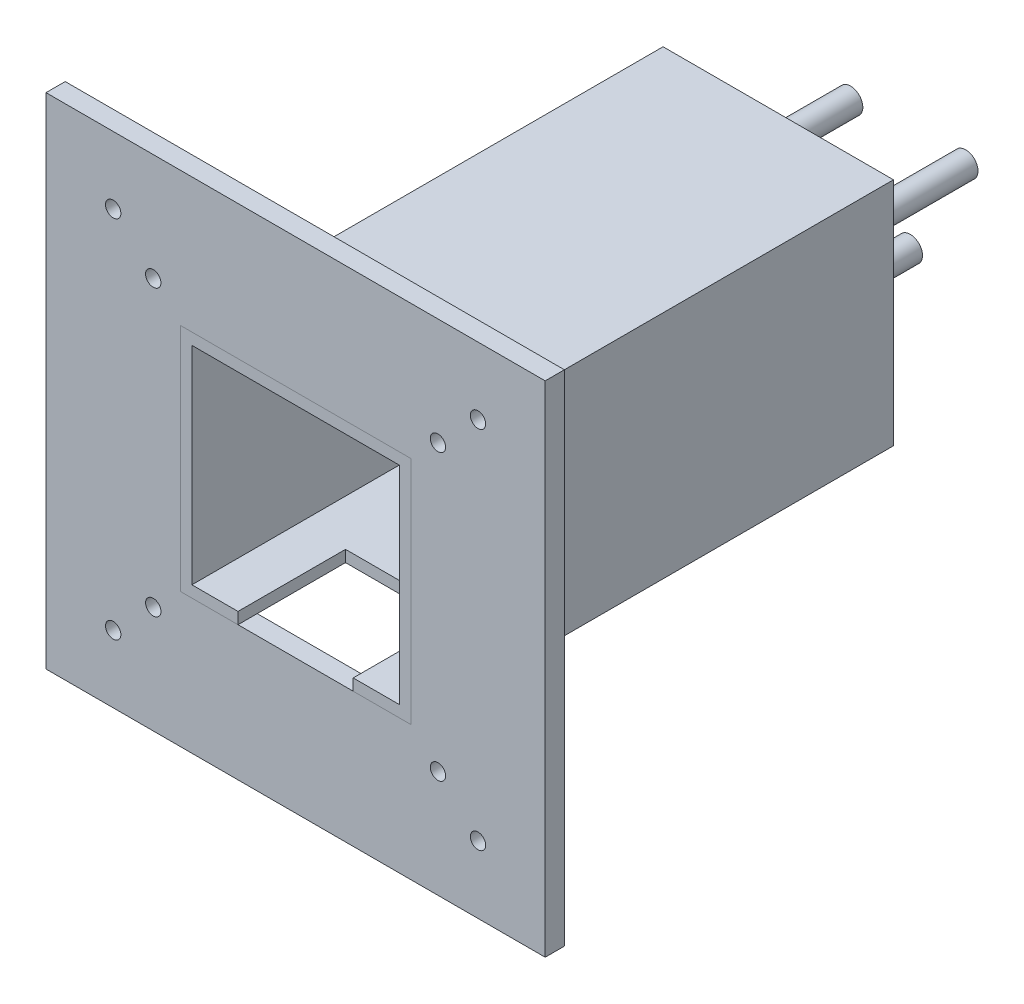
from build123d import *

# Parameters (mm, degrees)
SKETCH1_W           = 60
SKETCH1_H           = 60
SKETCH1_R           = 9
SKETCH1_R_2         = 1.5
BOSS_EXTRUDE1_DEPTH = 4
SKETCH2_R           = 18
SKETCH2_R_2         = 16
BOSS_EXTRUDE2_DEPTH = 30
SKETCH4_R           = 3.2
SKETCH4_R_2         = 2.7
BOSS_EXTRUDE6_DEPTH = 34
SKETCH5_W           = 60
SKETCH5_H           = 60
SKETCH5_W_2         = 54
SKETCH5_H_2         = 54
BOSS_EXTRUDE7_DEPTH = 121.7
SKETCH7_W           = 30
SKETCH7_H           = 28
CUT_EXTRUDE1_DEPTH  = 30.7
SKETCH8_W           = 130
SKETCH8_H           = 130
SKETCH8_R           = 2
SKETCH8_W_2         = 60
SKETCH8_H_2         = 60
BOSS_EXTRUDE8_DEPTH = 5


with BuildPart() as part:
    # Sketch1 → Boss-Extrude1 (new body)
    with BuildSketch(Plane.XY):
        with Locations((-9.011180766, -6.125993037)):
            Rectangle(SKETCH1_W, SKETCH1_H)
        with Locations((-9.011180766, -6.125993037)):
            Circle(SKETCH1_R, mode=Mode.SUBTRACT)
        with Locations((-17.995470725, 2.892105033)):
            Circle(SKETCH1_R_2, mode=Mode.SUBTRACT)
        with Locations((-18.051854011, -15.107894967)):
            Circle(SKETCH1_R_2, mode=Mode.SUBTRACT)
        with Locations((0.004529275, 2.892105033)):
            Circle(SKETCH1_R_2, mode=Mode.SUBTRACT)
        with Locations((-0.051854011, -15.107894967)):
            Circle(SKETCH1_R_2, mode=Mode.SUBTRACT)
    extrude(amount=BOSS_EXTRUDE1_DEPTH)

    # Sketch2 → Boss-Extrude2 (add)
    with BuildSketch(Plane.XY.offset(4)):
        with Locations((-9.011180766, -6.125993037)):
            Circle(SKETCH2_R)
        with Locations((-9.011180766, -6.125993037)):
            Circle(SKETCH2_R_2, mode=Mode.SUBTRACT)
    extrude(amount=BOSS_EXTRUDE2_DEPTH)

    # Sketch4 → Boss-Extrude6 (add)
    # profile 1 of 3: a face of its own
    with BuildSketch(Plane(origin=(0, 0, 0), x_dir=(-1, 0, 0), z_dir=(0, 0, -1))):
        with Locations(Location((-5.803539584, 2.84752695, 0), (0, 0, 180))):
            Circle(SKETCH4_R)
        with Locations((-5.803539584, 2.84752695)):
            Circle(SKETCH4_R_2, mode=Mode.SUBTRACT)
    # profile 2 of 3: a face of its own
    with BuildSketch(Plane(origin=(0, 0, 0), x_dir=(-1, 0, 0), z_dir=(0, 0, -1))):
        with Locations(Location((24.189837211, 2.217171142, 0), (0, 0, 180))):
            Circle(SKETCH4_R)
        with Locations((24.189837211, 2.217171142)):
            Circle(SKETCH4_R_2, mode=Mode.SUBTRACT)
    # profile 3 of 3: a face of its own
    with BuildSketch(Plane(origin=(0, 0, 0), x_dir=(-1, 0, 0), z_dir=(0, 0, -1))):
        with Locations(Location((8.64724467, -23.442677204, 0), (0, 0, 180))):
            Circle(SKETCH4_R)
        with Locations((8.64724467, -23.442677204)):
            Circle(SKETCH4_R_2, mode=Mode.SUBTRACT)
    extrude(amount=BOSS_EXTRUDE6_DEPTH)

    # Sketch5 → Boss-Extrude7 (add)
    with BuildSketch(Plane.XY.offset(4)):
        with Locations((-9.011180766, -6.125993037)):
            Rectangle(SKETCH5_W, SKETCH5_H)
        with Locations((-9.011180766, -6.125993037)):
            Rectangle(SKETCH5_W_2, SKETCH5_H_2, mode=Mode.SUBTRACT)
    extrude(amount=BOSS_EXTRUDE7_DEPTH)

    # Sketch7 → Cut-Extrude1 (cut)
    with BuildSketch(Plane.XZ.offset(36.125993037)):
        with Locations((-9.011180766, 111.7)):
            Rectangle(SKETCH7_W, SKETCH7_H)
    extrude(amount=-CUT_EXTRUDE1_DEPTH, mode=Mode.SUBTRACT)


with BuildPart() as body_2:
    # Sketch8 → Boss-Extrude8 (new body)
    with BuildSketch(Plane.XY.offset(125.7)):
        with Locations((-9.011180766, -6.125993037)):
            Rectangle(SKETCH8_W, SKETCH8_H)
        with Locations((-56.511180766, 41.374006963)):
            Circle(SKETCH8_R, mode=Mode.SUBTRACT)
        with Locations((-46.082248578, 30.945074775)):
            Circle(SKETCH8_R, mode=Mode.SUBTRACT)
        with Locations((-9.011180766, -6.125993037)):
            Rectangle(SKETCH8_W_2, SKETCH8_H_2, mode=Mode.SUBTRACT)
        with Locations((28.059887046, -43.197060849)):
            Circle(SKETCH8_R, mode=Mode.SUBTRACT)
        with Locations((38.488819234, -53.625993037)):
            Circle(SKETCH8_R, mode=Mode.SUBTRACT)
        with Locations((-56.511180766, -53.625993037)):
            Circle(SKETCH8_R, mode=Mode.SUBTRACT)
        with Locations((-46.082248578, -43.197060849)):
            Circle(SKETCH8_R, mode=Mode.SUBTRACT)
        with Locations((28.059887046, 30.945074775)):
            Circle(SKETCH8_R, mode=Mode.SUBTRACT)
        with Locations((38.488819234, 41.374006963)):
            Circle(SKETCH8_R, mode=Mode.SUBTRACT)
    extrude(amount=-BOSS_EXTRUDE8_DEPTH)


solid = Compound([part.part, body_2.part])
